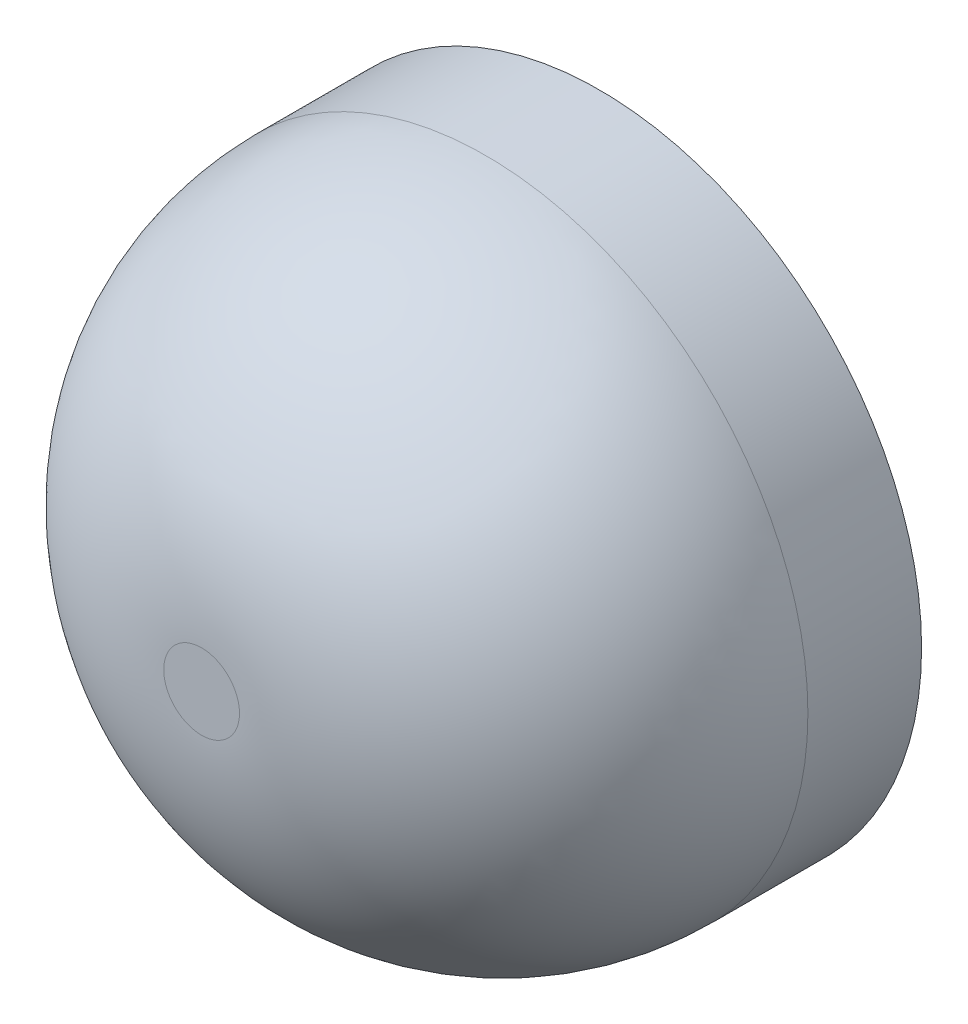
from build123d import *

# Parameters (mm, degrees)
SKETCH1_R           = 17
BOSS_EXTRUDE1_DEPTH = 21
FILLET1_R           = 15
SHELL1_T            = -1


with BuildPart() as part:
    # Sketch1 → Boss-Extrude1 (new body)
    with BuildSketch(Plane.XY):
        Circle(SKETCH1_R)
    extrude(amount=BOSS_EXTRUDE1_DEPTH)

    # Fillet1
    fillet1_edges = [part.edges().sort_by_distance(p)[0] for p in [
        (-17, 0, 21),
    ]]
    fillet(fillet1_edges, radius=FILLET1_R)

    # Shell1
    shell1_openings = [part.faces().sort_by_distance(p)[0] for p in [
        (0, 0, 0),
    ]]
    offset(amount=SHELL1_T, openings=shell1_openings, kind=Kind.INTERSECTION)


solid = part.part
